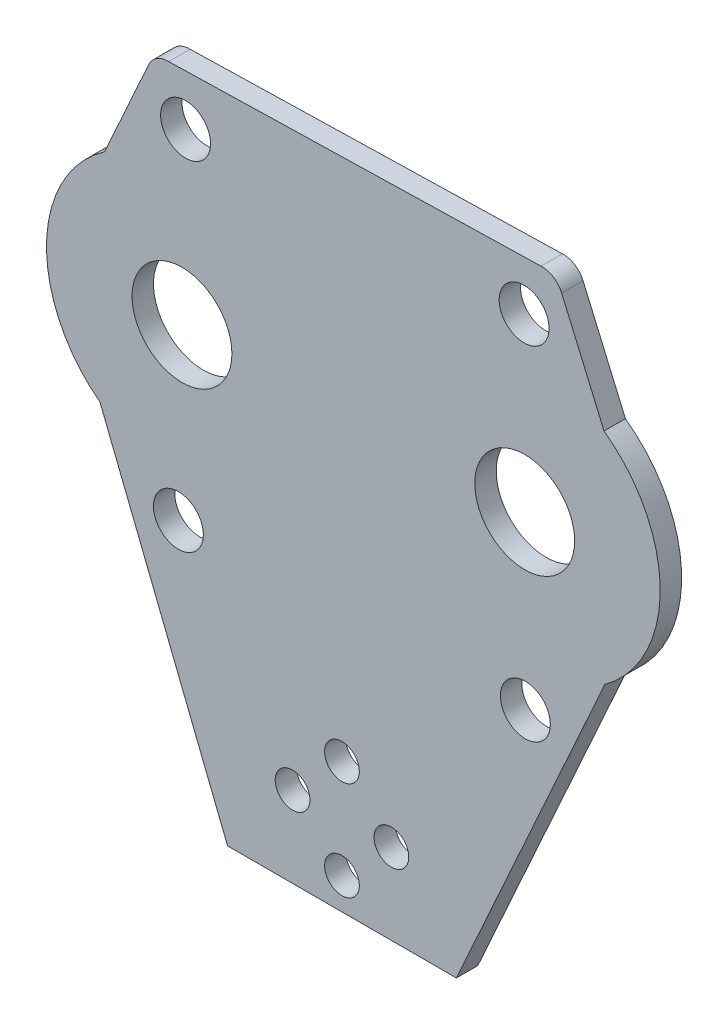
from build123d import *

# Parameters (mm, degrees)
SKETCH1_W           = 95
SKETCH1_H           = 100
BOSS_EXTRUDE1_DEPTH = 3
CUT_EXTRUDE3_DEPTH  = 3
SKETCH5_R           = 2.43527257
SKETCH5_R_2         = 7
SKETCH5_R_3         = 3.5
CUT_EXTRUDE4_DEPTH  = 3


with BuildPart() as part:
    # Sketch1 → Boss-Extrude1 (new body)
    with BuildSketch(Plane.XY):
        with Locations((47.5, -50)):
            Rectangle(SKETCH1_W, SKETCH1_H)
    extrude(amount=BOSS_EXTRUDE1_DEPTH)

    # Sketch4 → Cut-Extrude3 (cut)
    with BuildSketch(Plane.XY.offset(3)):
        Polygon((33.610991992, -100), (62.120295215, -100), (95, -100), (95, 0), (0, 0), (0, -100), align=None)
        with BuildLine():
            Line((78.778954762, -5.219976488), (84.72769663, -19.012180272))
            ThreePointArc((84.72769663, -19.012180272), (92.605897001, -34.348605074), (84.838305738, -49.741346636))
            Line((84.838305738, -49.741346636), (64.0242126, -95.787997202))
            Line((64.0242126, -95.787997202), (31.934866328, -95.787997202))
            Line((31.934866328, -95.787997202), (14.049192276, -50.842376041))
            ThreePointArc((14.049192276, -50.842376041), (6.549499619, -35.317345386), (14.692273517, -20.119740309))
            Line((14.692273517, -20.119740309), (20.879119665, -6.432689868))
            ThreePointArc((20.879119665, -6.432689868), (22.012480764, -5.130871888), (23.675593701, -4.669035561))
            Line((23.675593701, -4.669035561), (75.890580945, -3.41108885))
            ThreePointArc((75.890580945, -3.41108885), (75.952006311, -3.408979239), (76.013462004, -3.408128439))
            ThreePointArc((76.013462004, -3.408128439), (77.66832232, -3.898714586), (78.778954762, -5.219976488))
        make_face(mode=Mode.SUBTRACT)
    extrude(amount=-CUT_EXTRUDE3_DEPTH, mode=Mode.SUBTRACT)

    # Sketch5 → Cut-Extrude4 (cut)
    with BuildSketch(Plane.XY.offset(3)):
        with Locations((54.906624154, -84.449867327)):
            Circle(SKETCH5_R)
        with Locations((47.979539464, -91.376952018)):
            Circle(SKETCH5_R)
        with Locations((41.052454773, -84.449867327)):
            Circle(SKETCH5_R)
        with Locations((47.979539464, -77.522782636)):
            Circle(SKETCH5_R)
        with Locations((73.606020085, -34.416994806)):
            Circle(SKETCH5_R_2)
        with Locations((25.545338638, -35.714963215)):
            Circle(SKETCH5_R_2)
        with Locations((25.043084538, -59.70970724)):
            Circle(SKETCH5_R_3)
        with Locations((26.047592738, -11.72021919)):
            Circle(SKETCH5_R_3)
        with Locations((73.692407115, -58.416839333)):
            Circle(SKETCH5_R_3)
        with Locations((73.519633055, -10.41715028)):
            Circle(SKETCH5_R_3)
    extrude(amount=-CUT_EXTRUDE4_DEPTH, mode=Mode.SUBTRACT)


solid = part.part
